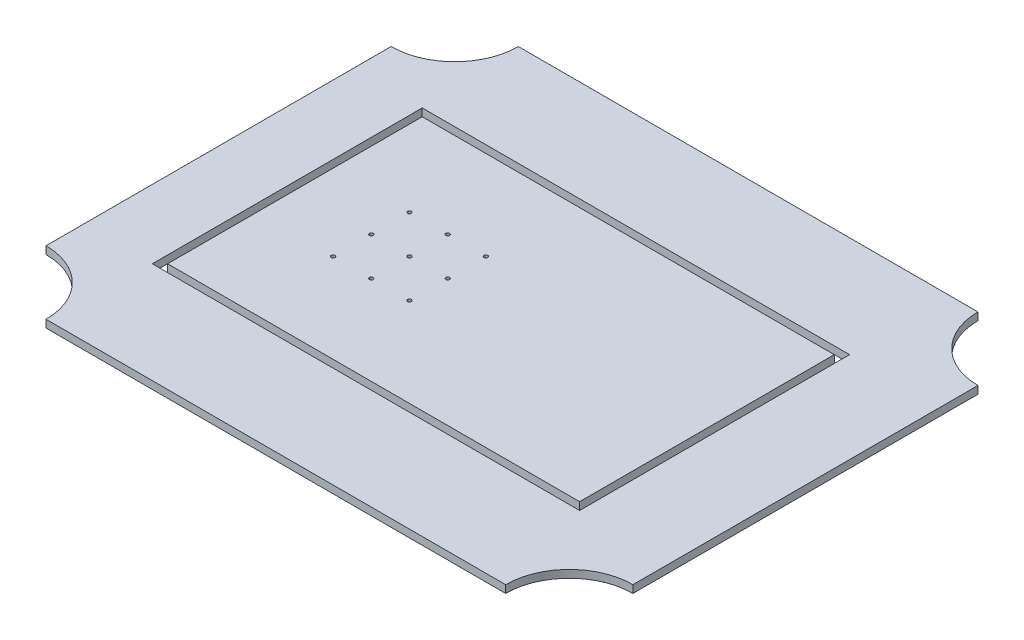
from build123d import *

# Parameters (mm, degrees)
SKETCH_1_W        = 335.624595469
SKETCH_1_H        = 212
EXTRUDE_1_DEPTH   = 6
SKETCH_1_W_2      = 323.624595469
SKETCH_1_H_2      = 200
SKETCH_1_R        = 1.5
EXTRUDE_1_2_DEPTH = 6


with BuildPart() as part:
    # 草图1 → 凸台-拉伸1 (new body)
    with BuildSketch(Plane(origin=(0, 0, 0), x_dir=(1, 0, 0), z_dir=(0, 1, 0))):
        with BuildLine():
            ThreePointArc((-145.691499512, -185.5), (-160.336160453, -150.144660941), (-195.691499512, -135.5))
            Line((-195.691499512, -135.5), (-195.691499512, 135.5))
            ThreePointArc((-195.691499512, 135.5), (-160.336160453, 150.144660941), (-145.691499512, 185.5))
            Line((-145.691499512, 185.5), (215.308500488, 185.5))
            ThreePointArc((215.308500488, 185.5), (229.953161429, 150.144660941), (265.308500488, 135.5))
            Line((265.308500488, 135.5), (265.308500488, -135.5))
            ThreePointArc((265.308500488, -135.5), (229.953161429, -150.144660941), (215.308500488, -185.5))
            Line((215.308500488, -185.5), (-145.691499512, -185.5))
        make_face()
        with Locations((26.120798222, 0)):
            Rectangle(SKETCH_1_W, SKETCH_1_H, mode=Mode.SUBTRACT)
    extrude(amount=EXTRUDE_1_DEPTH)


with BuildPart() as body_2:
    # 草图1 → Extrude 1 2 (new body)
    with BuildSketch(Plane(origin=(0, 0, 0), x_dir=(1, 0, 0), z_dir=(0, 1, 0))):
        with Locations((26.120798222, 0)):
            Rectangle(SKETCH_1_W_2, SKETCH_1_H_2)
        with Locations(Location((-15.691499512, 0, 0), (0, 0, 270))):
            Circle(SKETCH_1_R, mode=Mode.SUBTRACT)
        with Locations(Location((-15.691499512, -30, 0), (0, 0, 270))):
            Circle(SKETCH_1_R, mode=Mode.SUBTRACT)
        with Locations(Location((-45.691499512, -30, 0), (0, 0, 270))):
            Circle(SKETCH_1_R, mode=Mode.SUBTRACT)
        with Locations(Location((-45.691499512, 0, 0), (0, 0, 270))):
            Circle(SKETCH_1_R, mode=Mode.SUBTRACT)
        with Locations(Location((-45.691499512, 30, 0), (0, 0, 270))):
            Circle(SKETCH_1_R, mode=Mode.SUBTRACT)
        with Locations(Location((-75.691499512, 30, 0), (0, 0, 270))):
            Circle(SKETCH_1_R, mode=Mode.SUBTRACT)
        with Locations(Location((-75.691499512, 0, 0), (0, 0, 270))):
            Circle(SKETCH_1_R, mode=Mode.SUBTRACT)
        with Locations(Location((-75.691499512, -30, 0), (0, 0, 270))):
            Circle(SKETCH_1_R, mode=Mode.SUBTRACT)
        with Locations(Location((-15.691499512, 30, 0), (0, 0, 270))):
            Circle(SKETCH_1_R, mode=Mode.SUBTRACT)
    extrude(amount=EXTRUDE_1_2_DEPTH)


solid = Compound([part.part, body_2.part])
